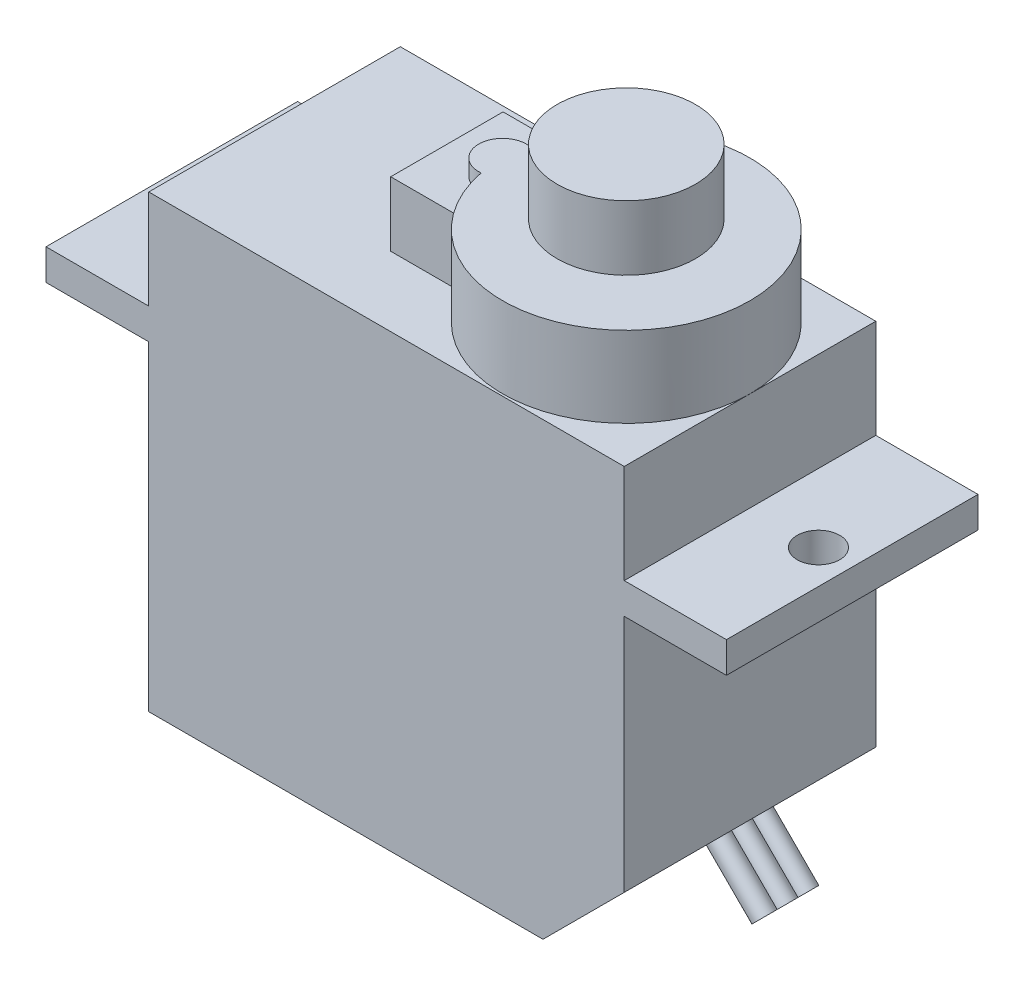
from build123d import *

# Parameters (mm, degrees)
BOSS_EXTRUDE1_DEPTH     = 12.2
SKETCH4_W               = 33
SKETCH4_H               = 1.5
BOSS_EXTRUDE2_DEPTH     = 12.2
CUT_EXTRUDE1_DEPTH      = 35.968525165
CUT_EXTRUDE1_DEPTH_BACK = 35.968525165
SKETCH6_R               = 1.03
CUT_EXTRUDE2_DEPTH      = 35.968525165
CUT_EXTRUDE2_DEPTH_BACK = 35.968525165
SKETCH7_R               = 1.03
SKETCH9_R               = 6
BOSS_EXTRUDE3_DEPTH     = 8.74
SKETCH11_R              = 1.16
BOSS_EXTRUDE4_DEPTH     = 8.74
SKETCH13_W              = 5.4
SKETCH13_H              = 5.45
BOSS_EXTRUDE5_DEPTH     = 7.96
SKETCH14_R              = 2.345
BOSS_EXTRUDE6_DEPTH     = 11.51
SKETCH15_R              = 0.635
CUT_EXTRUDE3_DEPTH      = 3.13
BOSS_EXTRUDE7_START     = 0.8
SKETCH17_R              = 3.355
BOSS_EXTRUDE7_DEPTH     = 3.13
SKETCH18_R              = 0.5
BOSS_EXTRUDE8_DEPTH     = 3.13


with BuildPart() as part:
    # Sketch1 → Boss-Extrude1 (new body)
    with BuildSketch(Plane.XY):
        Polygon((19.12, 0), (23.06, 3.94), (23.06, 21.83), (0, 21.83), (0, 0), align=None)
    extrude(amount=-BOSS_EXTRUDE1_DEPTH)



with BuildPart() as body_2:
    # Sketch4 → Boss-Extrude2 (new body)
    with BuildSketch(Plane.XY):
        with Locations((11.517097498, 16.2852801)):
            Rectangle(SKETCH4_W, SKETCH4_H)
    extrude(amount=-BOSS_EXTRUDE2_DEPTH)

    # Sketch6 → Cut-Extrude1 (cut, two sides: drawn at the far end of the back side and taken through both)
    with BuildSketch(Plane(origin=(0, 17, 0), x_dir=(1, 0, 0), z_dir=(0, 1, 0)).offset(-CUT_EXTRUDE1_DEPTH_BACK)):
        with Locations(Location((-3.31, 6.1, 0), (0, 0, 270))):
            Circle(SKETCH6_R)
    extrude(amount=CUT_EXTRUDE1_DEPTH + CUT_EXTRUDE1_DEPTH_BACK, mode=Mode.SUBTRACT)

    # Sketch7 → Cut-Extrude2 (cut, two sides: drawn at the far end of the back side and taken through both)
    with BuildSketch(Plane(origin=(0, 17, 0), x_dir=(1, 0, 0), z_dir=(0, 1, 0)).offset(-CUT_EXTRUDE2_DEPTH_BACK)):
        with Locations(Location((26.38, 6.1, 0), (0, 0, 270))):
            Circle(SKETCH7_R)
    extrude(amount=CUT_EXTRUDE2_DEPTH + CUT_EXTRUDE2_DEPTH_BACK, mode=Mode.SUBTRACT)


with BuildPart() as part_1:
    add(part.part)

    add(body_2.part)  # Boss-Extrude3 merges body 2
    # Sketch9 → Boss-Extrude3 (add)
    with BuildSketch(Plane(origin=(0, 17, 0), x_dir=(1, 0, 0), z_dir=(0, 1, 0))):
        with Locations((17.06, 6.1)):
            Circle(SKETCH9_R)
    extrude(amount=BOSS_EXTRUDE3_DEPTH)

    # Sketch11 → Boss-Extrude4 (add)
    with BuildSketch(Plane(origin=(0, 17, 0), x_dir=(1, 0, 0), z_dir=(0, 1, 0))):
        with Locations((11.06, 6.1)):
            Circle(SKETCH11_R)
    extrude(amount=BOSS_EXTRUDE4_DEPTH)

    # Sketch13 → Boss-Extrude5 (add)
    with BuildSketch(Plane(origin=(0, 17, 0), x_dir=(1, 0, 0), z_dir=(0, 1, 0))):
        with Locations((11.06, 6.1)):
            Rectangle(SKETCH13_W, SKETCH13_H)
    extrude(amount=BOSS_EXTRUDE5_DEPTH)

    # Sketch14 → Boss-Extrude6 (add)
    with BuildSketch(Plane(origin=(0, 17, 0), x_dir=(1, 0, 0), z_dir=(0, 1, 0))):
        with Locations(Location((17.06, 6.1, 0), (0, 0, 270))):
            Circle(SKETCH14_R)
    extrude(amount=BOSS_EXTRUDE6_DEPTH)

    # Sketch15 → Cut-Extrude3 (cut)
    with BuildSketch(Plane(origin=(0, 28.51, 0), x_dir=(1, 0, 0), z_dir=(0, 1, 0))):
        with Locations(Location((17.06, 6.1, 0), (0, 0, 270))):
            Circle(SKETCH15_R)
    extrude(amount=-CUT_EXTRUDE3_DEPTH, mode=Mode.SUBTRACT)

    # Sketch17 → Boss-Extrude7 (add)
    with BuildSketch(Plane(origin=(0, 28.51, 0), x_dir=(1, 0, 0), z_dir=(0, 1, 0)).offset(BOSS_EXTRUDE7_START)):
        with Locations(Location((17.06, 6.1, 0), (0, 0, 270))):
            Circle(SKETCH17_R)
    extrude(amount=-BOSS_EXTRUDE7_DEPTH)

    # Sketch18 → Boss-Extrude8 (add)
    with BuildSketch(Plane(origin=(9.56, -9.56, 0), x_dir=(0, 0, -1), z_dir=(0.7071067811865486, -0.7071067811865465, 0))):
        with Locations(Location((5.09, 18.386997448, 0), (0, 0, 90))):
            Circle(SKETCH18_R)
        with Locations(Location((6.1, 18.386997448, 0), (0, 0, 90))):
            Circle(SKETCH18_R)
        with Locations(Location((7.11, 18.386997448, 0), (0, 0, 90))):
            Circle(SKETCH18_R)
    extrude(amount=BOSS_EXTRUDE8_DEPTH)


solid = part_1.part
